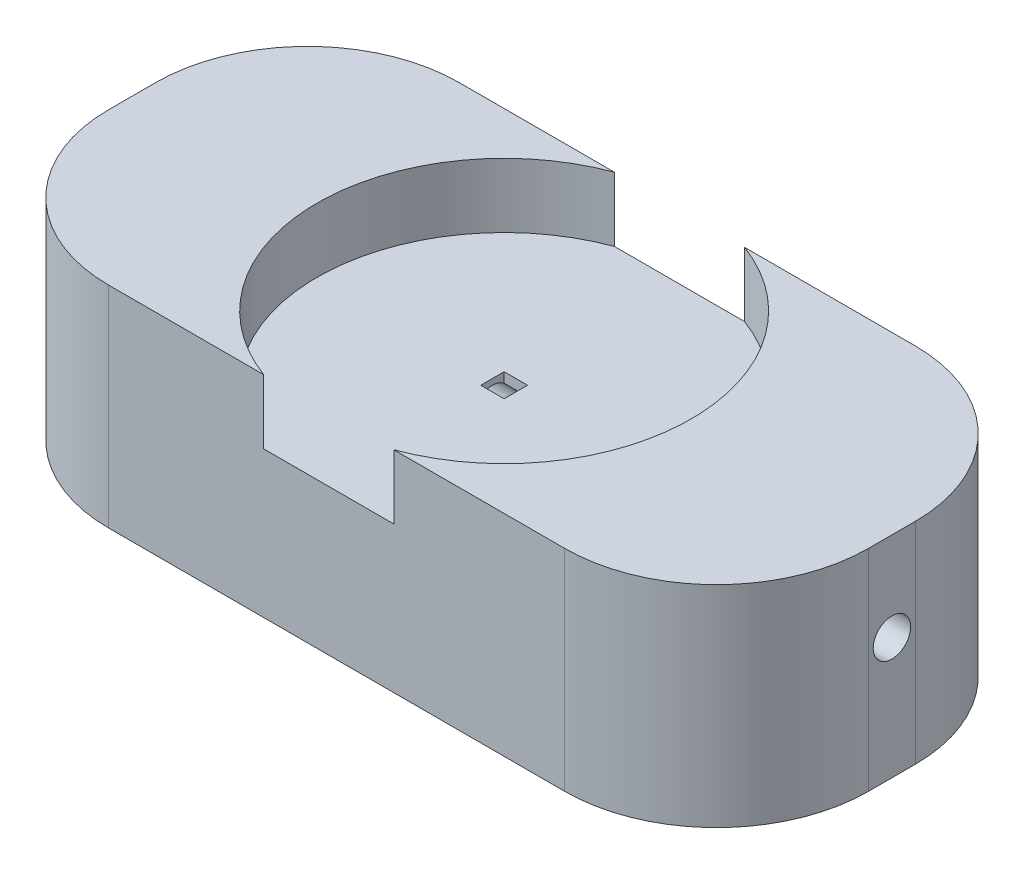
from build123d import *

# Parameters (mm, degrees)
SKETCH1_W           = 65
SKETCH1_H           = 30
BOSS_EXTRUDE1_DEPTH = 58
FILLET1_R           = 13
SKETCH15_W          = 83.696095513
SKETCH15_H          = 31.69844841
CUT_EXTRUDE7_DEPTH  = 50
SKETCH18_R          = 16
CUT_EXTRUDE10_DEPTH = 5.5
SKETCH3_R           = 1.6
CUT_EXTRUDE12_DEPTH = 89.396832522
SKETCH21_W          = 2
SKETCH21_H          = 2
CUT_EXTRUDE13_DEPTH = 8


with BuildPart() as part:
    # Sketch1 → Boss-Extrude1 (new body)
    with BuildSketch(Plane(origin=(0, 0, 0), x_dir=(1, 0, 0), z_dir=(0, 1, 0))):
        with Locations((7.5, 0)):
            Rectangle(SKETCH1_W, SKETCH1_H)
    extrude(amount=BOSS_EXTRUDE1_DEPTH)

    # Fillet1
    fillet1_edges = [part.edges().sort_by_distance(p)[0] for p in [
        (40, 29, 15),
        (-25, 29, 15),
        (-25, 29, -15),
        (40, 29, -15),
    ]]
    fillet(fillet1_edges, radius=FILLET1_R)

    # Sketch15 → Cut-Extrude7 (cut)
    with BuildSketch(Plane(origin=(0, -10, 0), x_dir=(-1, 0, 0), z_dir=(0, -1, 0))):
        with Locations((-0.057440767, 0.030479277)):
            Rectangle(SKETCH15_W, SKETCH15_H)
    extrude(amount=-CUT_EXTRUDE7_DEPTH, mode=Mode.SUBTRACT)

    # Sketch18 → Cut-Extrude10 (cut)
    with BuildSketch(Plane(origin=(0, 58, 0), x_dir=(1, 0, 0), z_dir=(0, 1, 0))):
        with Locations((6.828508286, 0)):
            Circle(SKETCH18_R)
    extrude(amount=-CUT_EXTRUDE10_DEPTH, mode=Mode.SUBTRACT)

    # Sketch3 → Cut-Extrude12 (cut, through all)
    with BuildSketch(Plane.ZY.offset(25)):
        with Locations((0, 50.4)):
            Circle(SKETCH3_R)
    extrude(amount=-CUT_EXTRUDE12_DEPTH, mode=Mode.SUBTRACT)

    # Sketch21 → Cut-Extrude13 (cut)
    with BuildSketch(Plane(origin=(0, 52.5, 0), x_dir=(1, 0, 0), z_dir=(0, 1, 0))):
        with Locations((6.828508286, 0)):
            Rectangle(SKETCH21_W, SKETCH21_H)
    extrude(amount=-CUT_EXTRUDE13_DEPTH, mode=Mode.SUBTRACT)


solid = part.part
